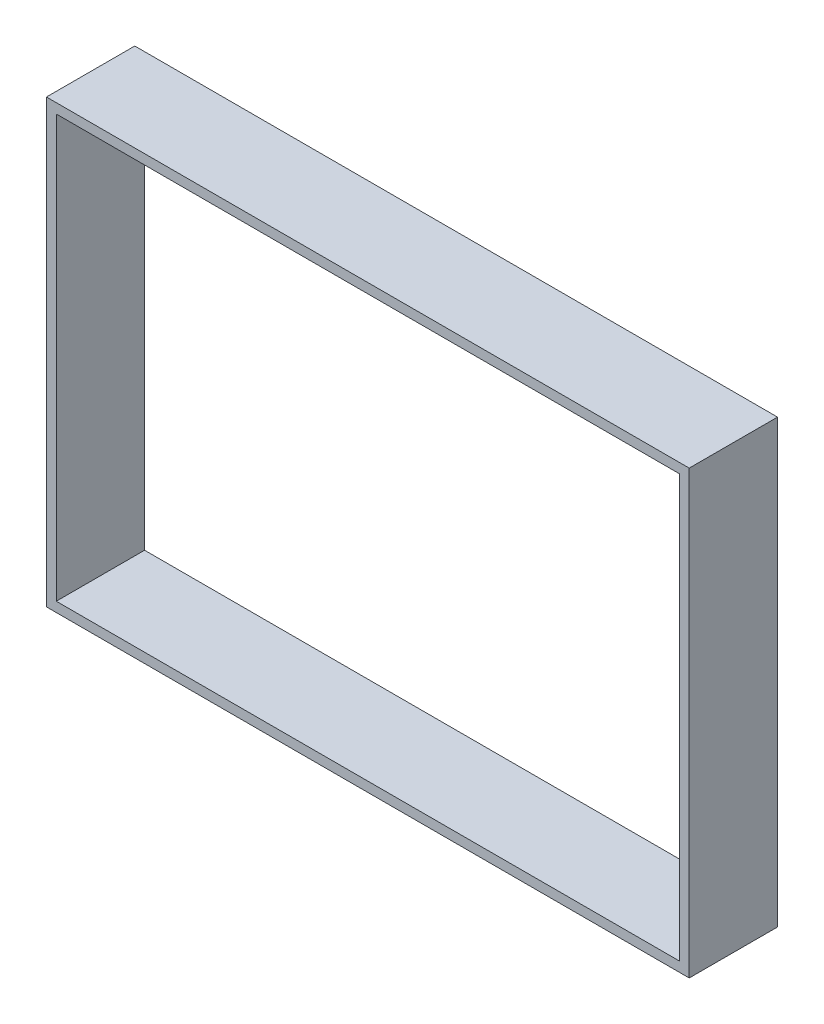
from build123d import *

# Parameters (mm, degrees)
SKETCH1_W           = 131
SKETCH1_H           = 90
SKETCH1_W_2         = 127
SKETCH1_H_2         = 86
BOSS_EXTRUDE1_DEPTH = 18


with BuildPart() as part:
    # Sketch1 → Boss-Extrude1 (new body)
    with BuildSketch(Plane.XY):
        with Locations((-5.406821107, -13.975804376)):
            Rectangle(SKETCH1_W, SKETCH1_H)
        with Locations((-5.406821107, -13.975804376)):
            Rectangle(SKETCH1_W_2, SKETCH1_H_2, mode=Mode.SUBTRACT)
    extrude(amount=BOSS_EXTRUDE1_DEPTH)


solid = part.part
